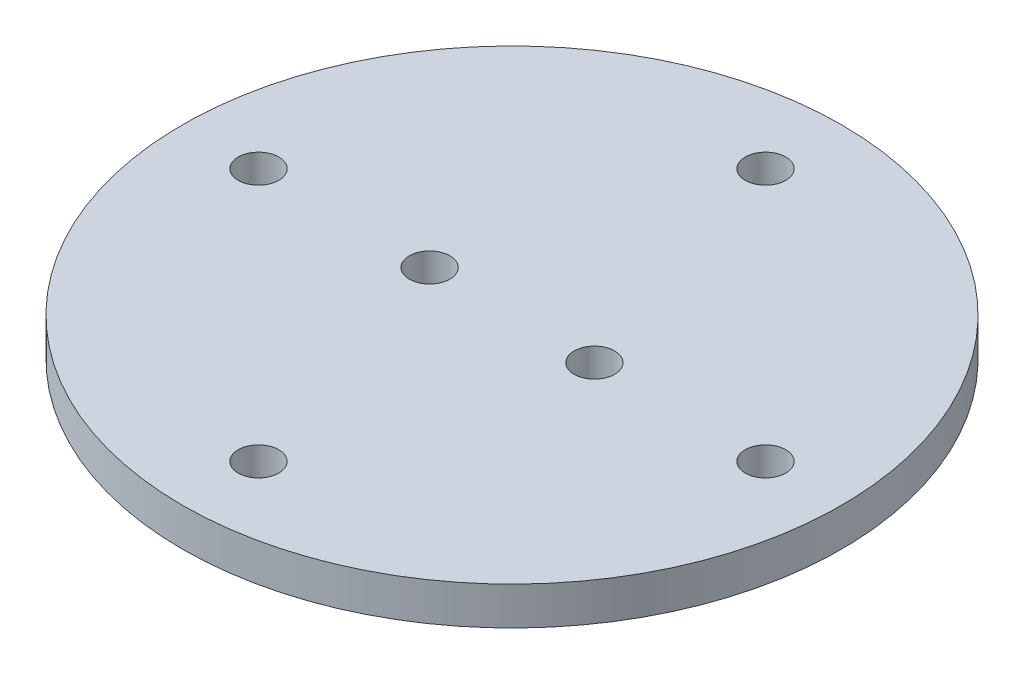
from build123d import *

# Parameters (mm, degrees)
SKETCH_1_R      = 26
SKETCH_1_R_2    = 1.6
EXTRUDE_1_DEPTH = 3


with BuildPart() as part:
    # 草图1 → 凸台-拉伸1 (new body)
    with BuildSketch(Plane(origin=(0, 0, 0), x_dir=(1, 0, 0), z_dir=(0, 1, 0))):
        with Locations(Location((0, 0, 0), (0, 0, 270))):
            Circle(SKETCH_1_R)
        with Locations(Location((-6.5, 0, 0), (0, 0, 270))):
            Circle(SKETCH_1_R_2, mode=Mode.SUBTRACT)
        with Locations(Location((6.5, 0, 0), (0, 0, 270))):
            Circle(SKETCH_1_R_2, mode=Mode.SUBTRACT)
        with Locations(Location((-20, 0, 0), (0, 0, 270))):
            Circle(SKETCH_1_R_2, mode=Mode.SUBTRACT)
        with Locations(Location((0, 20, 0), (0, 0, 270))):
            Circle(SKETCH_1_R_2, mode=Mode.SUBTRACT)
        with Locations(Location((20, 0, 0), (0, 0, 270))):
            Circle(SKETCH_1_R_2, mode=Mode.SUBTRACT)
        with Locations(Location((0, -20, 0), (0, 0, 270))):
            Circle(SKETCH_1_R_2, mode=Mode.SUBTRACT)
    extrude(amount=EXTRUDE_1_DEPTH)


solid = part.part
